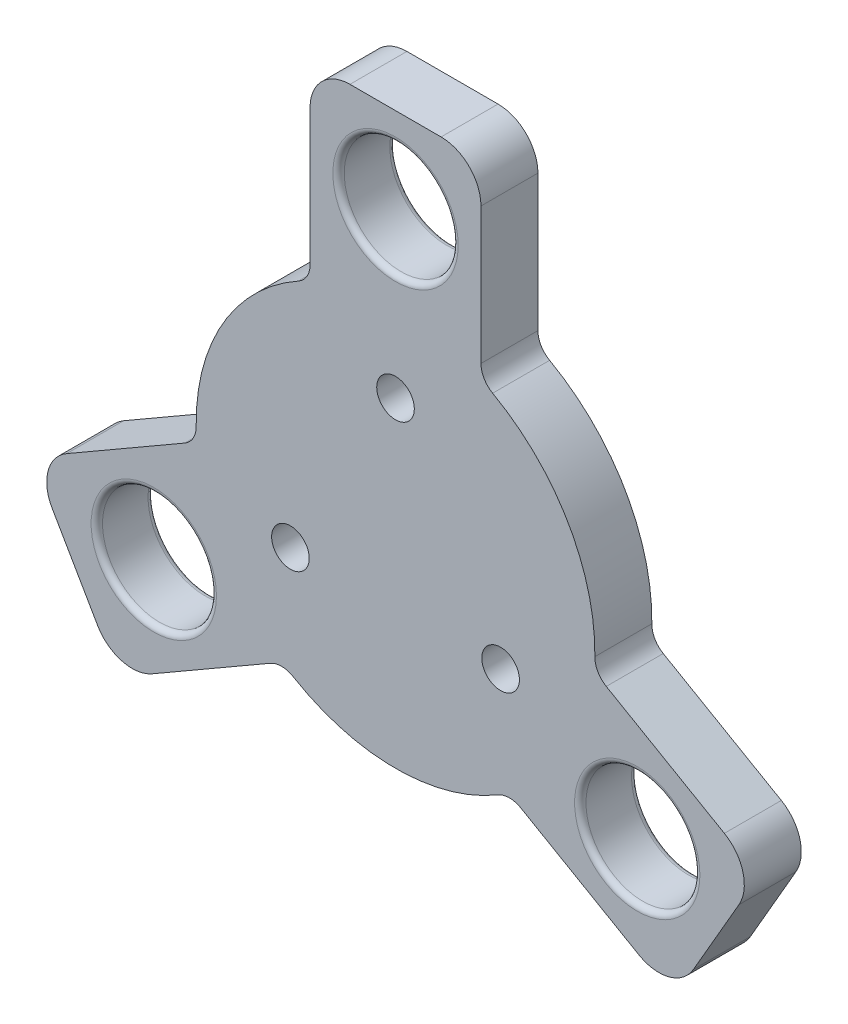
from build123d import *

# Parameters (mm, degrees)
SKETCH1_R           = 5
SKETCH1_R_2         = 17.5
SKETCH1_R_3         = 2.4
BOSS_EXTRUDE1_DEPTH = 5
FILLET1_R           = 3.5
FILLET2_R           = 2
FILLET3_R           = 0.5
SKETCH3_R           = 1.65
CUT_EXTRUDE1_DEPTH  = 5


with BuildPart() as part:
    # Sketch1 → Boss-Extrude1 (new body)
    # profile 1 of 5: a face of its own
    with BuildSketch(Plane.XY):
        with BuildLine():
            ThreePointArc((-9.943063938, -14.400884679), (-15.155444566, -8.75), (-17.443063938, -1.410503622))
            Line((-17.443063938, -1.410503622), (-31.895825623, -9.754809472))
            Line((-31.895825623, -9.754809472), (-24.395825623, -22.745190528))
            Line((-24.395825623, -22.745190528), (-9.943063938, -14.400884679))
        make_face()
        with Locations((-21.217622393, -12.25)):
            Circle(SKETCH1_R, mode=Mode.SUBTRACT)
    # profile 2 of 5: a face of its own
    with BuildSketch(Plane.XY):
        Circle(SKETCH1_R_2)
        Circle(SKETCH1_R_3, mode=Mode.SUBTRACT)
    # profile 3 of 5: a face of its own
    with BuildSketch(Plane.XY):
        with BuildLine():
            Line((31.895825623, -9.754809472), (17.443063938, -1.410503622))
            ThreePointArc((17.443063938, -1.410503622), (15.155444566, -8.75), (9.943063938, -14.400884679))
            Line((9.943063938, -14.400884679), (24.395825623, -22.745190528))
            Line((24.395825623, -22.745190528), (31.895825623, -9.754809472))
        make_face()
        with Locations((21.217622393, -12.25)):
            Circle(SKETCH1_R, mode=Mode.SUBTRACT)
    # profile 4 of 5: a face of its own
    with BuildSketch(Plane.XY):
        with BuildLine():
            Line((7.5, 32.5), (-7.5, 32.5))
            Line((-7.5, 32.5), (-7.5, 15.811388301))
            ThreePointArc((-7.5, 15.811388301), (0, 17.5), (7.5, 15.811388301))
            Line((7.5, 15.811388301), (7.5, 32.5))
        make_face()
        with Locations((0, 25)):
            Circle(SKETCH1_R, mode=Mode.SUBTRACT)
    # profile 5 of 5: a face of its own
    with BuildSketch(Plane.XY):
        Circle(SKETCH1_R_3)
    extrude(amount=BOSS_EXTRUDE1_DEPTH)

    # Fillet1
    fillet1_edges = [part.edges().sort_by_distance(p)[0] for p in [
        (-24.395825623, -22.745190528, 2.5),
        (-31.895825623, -9.754809472, 2.5),
        (-7.5, 32.5, 2.5),
        (7.5, 32.5, 2.5),
        (31.895825623, -9.754809472, 2.5),
        (24.395825623, -22.745190528, 2.5),
    ]]
    fillet(fillet1_edges, radius=FILLET1_R)

    # Fillet2
    fillet2_edges = [part.edges().sort_by_distance(p)[0] for p in [
        (-17.443063938, -1.410503622, 2.5),
        (-7.5, 15.811388301, 2.5),
        (7.5, 15.811388301, 2.5),
        (17.443063938, -1.410503622, 2.5),
        (9.943063938, -14.400884679, 2.5),
        (-9.943063938, -14.400884679, 2.5),
    ]]
    fillet(fillet2_edges, radius=FILLET2_R)

    # Fillet3
    fillet3_edges = [part.edges().sort_by_distance(p)[0] for p in [
        (16.217622393, -12.25, 0),
        (-5, 25, 0),
        (-26.217622393, -12.25, 0),
        (-26.217622393, -12.25, 5),
        (-5, 25, 5),
        (16.217622393, -12.25, 5),
    ]]
    fillet(fillet3_edges, radius=FILLET3_R)

    # Sketch3 → Cut-Extrude1 (cut)
    with BuildSketch(Plane(origin=(0, 0, 0), x_dir=(-1, 0, 0), z_dir=(0, 0, -1))):
        with Locations((-9.22317055, -5.325)):
            Circle(SKETCH3_R)
        with Locations((9.22317055, -5.325)):
            Circle(SKETCH3_R)
        with Locations((0, 10.65)):
            Circle(SKETCH3_R)
    extrude(amount=-CUT_EXTRUDE1_DEPTH, mode=Mode.SUBTRACT)


solid = part.part
